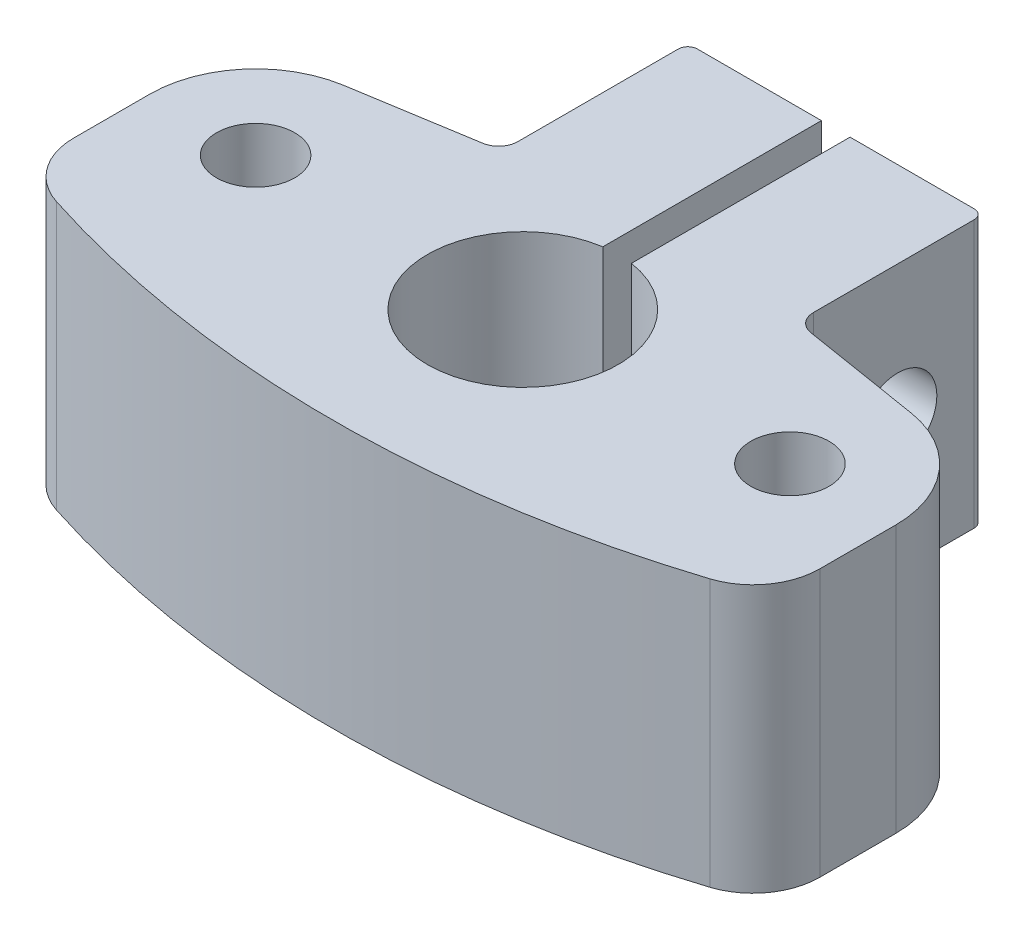
from build123d import *

# Parameters (mm, degrees)
SKETCH1_R           = 2.05
BOSS_EXTRUDE1_DEPTH = 14
SKETCH2_R           = 2.05
CUT_EXTRUDE1_DEPTH  = 35.788647574


with BuildPart() as part:
    # Sketch1 → Boss-Extrude1 (new body)
    with BuildSketch(Plane(origin=(0, 0, 0), x_dir=(1, 0, 0), z_dir=(0, 1, 0))):
        with BuildLine():
            Line((-19.55, 0), (-19.55, -3.98647317))
            ThreePointArc((-19.55, -3.98647317), (-18.877985148, -6.048632233), (-17.12, -7.318904715))
            ThreePointArc((-17.12, -7.318904715), (0, -10), (17.12, -7.318904715))
            ThreePointArc((17.12, -7.318904715), (18.877985148, -6.048632233), (19.55, -3.98647317))
            Line((19.55, -3.98647317), (19.55, 0))
            ThreePointArc((19.55, 0), (18.22693576, 3.59659757), (14.888553485, 5.478409687))
            Line((14.888553485, 5.478409687), (8.589900273, 6.5))
            ThreePointArc((8.589900273, 6.5), (7.988389953, 6.839065246), (7.75, 7.487100845))
            Line((7.75, 7.487100845), (7.75, 15.9))
            ThreePointArc((7.75, 15.9), (7.603553391, 16.253553391), (7.25, 16.4))
            Line((7.25, 16.4), (0.75, 16.4))
            Line((0.75, 16.4), (0.75, 4.943429983))
            ThreePointArc((0.75, 4.943429983), (0, -5), (-0.75, 4.943429983))
            Line((-0.75, 4.943429983), (-0.75, 16.4))
            Line((-0.75, 16.4), (-7.25, 16.4))
            ThreePointArc((-7.25, 16.4), (-7.603553391, 16.253553391), (-7.75, 15.9))
            Line((-7.75, 15.9), (-7.75, 7.487100845))
            ThreePointArc((-7.75, 7.487100845), (-7.988389953, 6.839065246), (-8.589900273, 6.5))
            Line((-8.589900273, 6.5), (-14.888553485, 5.478409687))
            ThreePointArc((-14.888553485, 5.478409687), (-18.22693576, 3.59659757), (-19.55, 0))
        make_face()
        with Locations(Location((-14, 0, 0), (0, 0, 270))):
            Circle(SKETCH1_R, mode=Mode.SUBTRACT)
        with Locations(Location((14, 0, 0), (0, 0, 270))):
            Circle(SKETCH1_R, mode=Mode.SUBTRACT)
    extrude(amount=BOSS_EXTRUDE1_DEPTH)

    # Sketch2 → Cut-Extrude1 (cut, through all)
    with BuildSketch(Plane(origin=(7.75, 0, 0), x_dir=(0, 0, -1), z_dir=(1, 0, 0))):
        with Locations((11.9, 7)):
            Circle(SKETCH2_R)
    extrude(amount=-CUT_EXTRUDE1_DEPTH, mode=Mode.SUBTRACT)


solid = part.part
